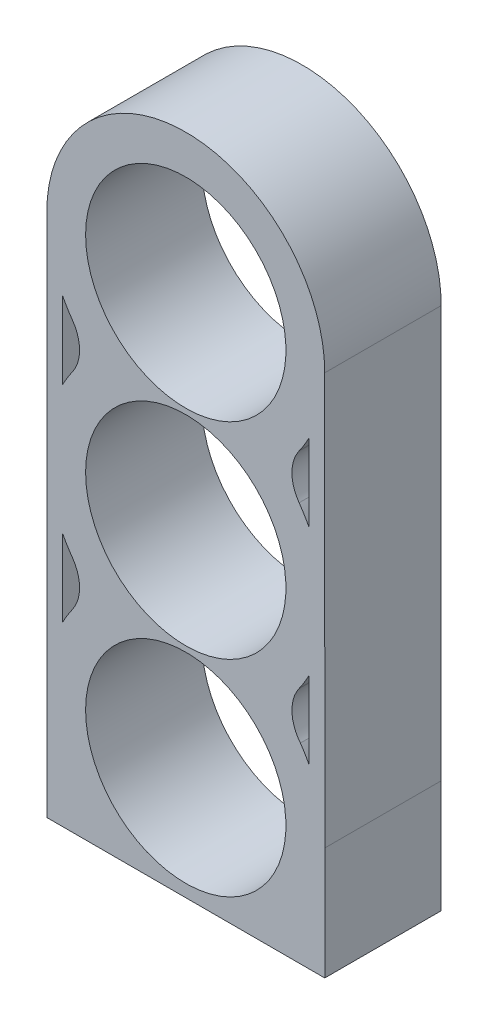
from build123d import *

# Parameters (mm, degrees)
SKETCH1_R           = 32.766
BOSS_EXTRUDE1_DEPTH = 38.1


with BuildPart() as part:
    # Sketch1 → Boss-Extrude1 (new body)
    with BuildSketch(Plane.XY):
        with BuildLine():
            ThreePointArc((45.466, 134.62), (0, 180.086), (-45.466, 134.62))
            Line((-45.466, 134.62), (-45.466, -36.83))
            Line((-45.466, -36.83), (45.472760733, -36.83))
            Line((45.472760733, -36.83), (45.472760733, 0))
            Line((45.472760733, 0), (45.466, 134.62))
        make_face()
        with Locations(Location((0, 0, 0), (0, 0, 180))):
            Circle(SKETCH1_R, mode=Mode.SUBTRACT)
        with BuildLine():
            Line((-40.386, 20.883681668), (-40.386, 46.426318332))
            ThreePointArc((-40.386, 46.426318332), (-38.829045243, 43.657042436), (-37.082505751, 41.003253275))
            ThreePointArc((-37.082505751, 41.003253275), (-34.740747581, 33.655), (-37.082505751, 26.306746725))
            ThreePointArc((-37.082505751, 26.306746725), (-38.829045243, 23.652957564), (-40.386, 20.883681668))
        make_face(mode=Mode.SUBTRACT)
        with Locations(Location((0, 67.31, 0), (0, 0, 180))):
            Circle(SKETCH1_R, mode=Mode.SUBTRACT)
        with BuildLine():
            ThreePointArc((37.082505751, 41.003253275), (38.831553537, 43.661160581), (40.390428727, 46.434885072))
            Line((40.390428727, 46.434885072), (40.391709837, 20.925359586))
            ThreePointArc((40.391709837, 20.925359586), (39.020141495, 23.38352957), (37.499160948, 25.752161572))
            ThreePointArc((37.499160948, 25.752161572), (34.745484352, 33.308169261), (37.082505751, 41.003253275))
        make_face(mode=Mode.SUBTRACT)
        with BuildLine():
            Line((-40.386, 88.193681668), (-40.386, 113.736318332))
            ThreePointArc((-40.386, 113.736318332), (-38.829045243, 110.967042436), (-37.082505751, 108.313253275))
            ThreePointArc((-37.082505751, 108.313253275), (-34.740747581, 100.965), (-37.082505751, 93.616746725))
            ThreePointArc((-37.082505751, 93.616746725), (-38.829045243, 90.962957564), (-40.386, 88.193681668))
        make_face(mode=Mode.SUBTRACT)
        with Locations(Location((0, 134.62, 0), (0, 0, 180))):
            Circle(SKETCH1_R, mode=Mode.SUBTRACT)
        with BuildLine():
            ThreePointArc((37.082505751, 108.313253275), (38.829639134, 110.968017404), (40.387048688, 113.738346468))
            Line((40.387048688, 113.738346468), (40.38833179, 88.189171708))
            ThreePointArc((40.38833179, 88.189171708), (38.830365823, 90.960789544), (37.082505751, 93.616746725))
            ThreePointArc((37.082505751, 93.616746725), (34.740747581, 100.965), (37.082505751, 108.313253275))
        make_face(mode=Mode.SUBTRACT)
    extrude(amount=BOSS_EXTRUDE1_DEPTH)


solid = part.part
